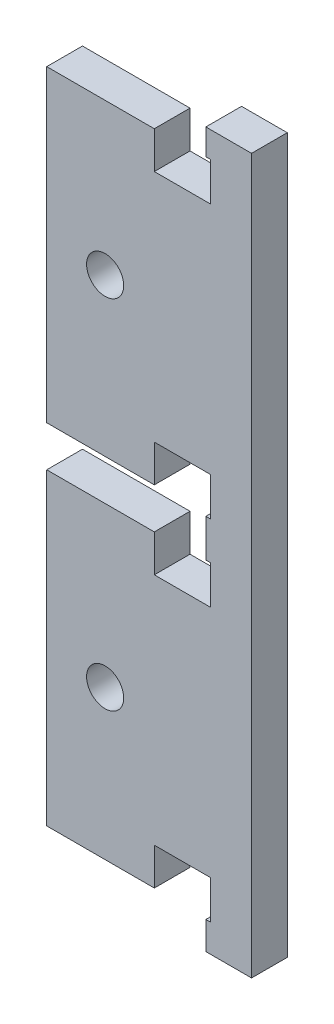
from build123d import *

# Parameters (mm, degrees)
SKETCH2_W               = 41.91
SKETCH2_H               = 190.436
BOSS_EXTRUDE1_DEPTH     = 6.35
SKETCH3_R               = 3.3
CUT_EXTRUDE1_DEPTH      = 478.183864302
SKETCH4_W               = 10.033
SKETCH4_H               = 6.858
CUT_EXTRUDE2_DEPTH      = 474.191260281
CUT_EXTRUDE3_DEPTH      = 474.191260281
CUT_EXTRUDE3_DEPTH_BACK = 474.191260281
SKETCH5_R               = 3.3


with BuildPart() as part:
    # Sketch2 → Boss-Extrude1 (new body)
    with BuildSketch(Plane.XY):
        with Locations((-327.245441571, 231.003658294)):
            Rectangle(SKETCH2_W, SKETCH2_H)
    extrude(amount=BOSS_EXTRUDE1_DEPTH)

    # Sketch3 → Cut-Extrude1 (cut, through all)
    with BuildSketch(Plane.XY.offset(6.35)):
        Polygon((-314.418441571, 195.840658294), (-314.418441571, 203.079658294), (-342.708441633, 203.079658294), (-342.708441633, 257.927658294), (-314.418441571, 257.927658294), (-314.418441571, 265.166658294), (-342.708441633, 265.166658294), (-342.708441633, 321.014658294), (-314.418441571, 321.014658294), (-314.418441571, 326.221658294), (-348.200441571, 326.221658294), (-348.200441571, 135.785658294), (-314.418441571, 135.785658294), (-314.418441571, 140.992658294), (-342.708441633, 140.992658294), (-342.708441633, 195.840658294), align=None)
        with Locations((-332.325441571, 294.535658294)):
            Circle(SKETCH3_R)
        with Locations((-332.325441571, 231.035658294)):
            Circle(SKETCH3_R)
        with Locations((-332.325441571, 167.535658294)):
            Circle(SKETCH3_R)
    extrude(amount=-CUT_EXTRUDE1_DEPTH, mode=Mode.SUBTRACT)

    # Sketch4 → Cut-Extrude2 (cut, through all)
    with BuildSketch(Plane.XY.offset(6.35)):
        with Locations((-318.564971808, 144.167658294)):
            Rectangle(SKETCH4_W, SKETCH4_H)
        with Locations((-318.564971808, 192.656258294)):
            Rectangle(SKETCH4_W, SKETCH4_H)
        with Locations((-318.564971808, 206.245258294)):
            Rectangle(SKETCH4_W, SKETCH4_H)
        with Locations((-318.564971808, 254.759258294)):
            Rectangle(SKETCH4_W, SKETCH4_H)
        with Locations((-318.564971808, 268.348258294)):
            Rectangle(SKETCH4_W, SKETCH4_H)
        with Locations((-318.564971808, 317.852858294)):
            Rectangle(SKETCH4_W, SKETCH4_H)
    extrude(amount=-CUT_EXTRUDE2_DEPTH, mode=Mode.SUBTRACT)

    # Sketch5 → Cut-Extrude3 (cut, two sides: drawn at the far end of the back side and taken through both)
    with BuildSketch(Plane.XY.offset(6.35).offset(-CUT_EXTRUDE3_DEPTH_BACK)):
        Polygon((-314.418441571, 264.919258294), (-314.418441571, 262.785658294), (-306.290441571, 262.785658294), (-306.290441571, 326.221658294), (-314.418441571, 326.221658294), (-314.418441571, 321.281858294), (-313.548471808, 321.281858294), (-313.548471808, 314.423858294), (-323.581471808, 314.423858294), (-323.581471808, 321.014658294), (-342.708441633, 321.014658294), (-342.708441633, 265.166658294), (-323.581471808, 265.166658294), (-323.581471808, 271.777258294), (-313.548471808, 271.777258294), (-313.548471808, 264.919258294), align=None)
        with Locations((-332.325441571, 294.535658294)):
            Circle(SKETCH5_R, mode=Mode.SUBTRACT)
    extrude(amount=CUT_EXTRUDE3_DEPTH + CUT_EXTRUDE3_DEPTH_BACK, mode=Mode.SUBTRACT)


solid = part.part
